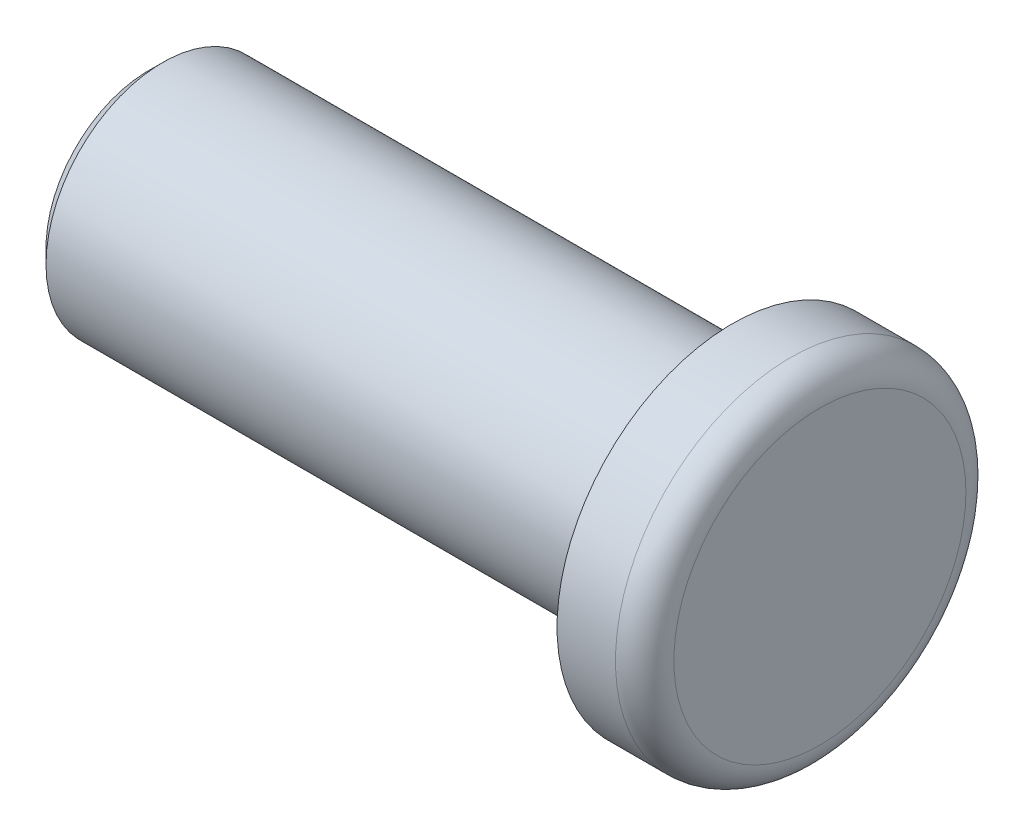
from build123d import *

# Parameters (mm, degrees)
SKETCH1_R           = 6
SKETCH1_R_2         = 4
BOSS_EXTRUDE1_DEPTH = 3
BOSS_EXTRUDE2_START = -23
SKETCH2_R           = 4
BOSS_EXTRUDE2_DEPTH = 23
FILLET1_R           = 1
CHAMFER1_SIZE       = 0.5


with BuildPart() as part:
    # Sketch1 → Boss-Extrude1 (new body)
    with BuildSketch(Plane(origin=(0, 0, 0), x_dir=(0, 0, -1), z_dir=(1, 0, 0))):
        Circle(SKETCH1_R)
        Circle(SKETCH1_R_2, mode=Mode.SUBTRACT)
    extrude(amount=BOSS_EXTRUDE1_DEPTH)

    # Sketch2 → Boss-Extrude2 (add)
    with BuildSketch(Plane(origin=(3, 0, 0), x_dir=(0, 0, -1), z_dir=(1, 0, 0)).offset(BOSS_EXTRUDE2_START)):
        Circle(SKETCH2_R)
    extrude(amount=BOSS_EXTRUDE2_DEPTH)

    # Fillet1
    fillet1_edges = [part.edges().sort_by_distance(p)[0] for p in [
        (3, 0, 6),
    ]]
    fillet(fillet1_edges, radius=FILLET1_R)

    # Chamfer1
    chamfer1_edges = [part.edges().sort_by_distance(p)[0] for p in [
        (-20, 0, 4),
    ]]
    chamfer(chamfer1_edges, length=CHAMFER1_SIZE)


solid = part.part
